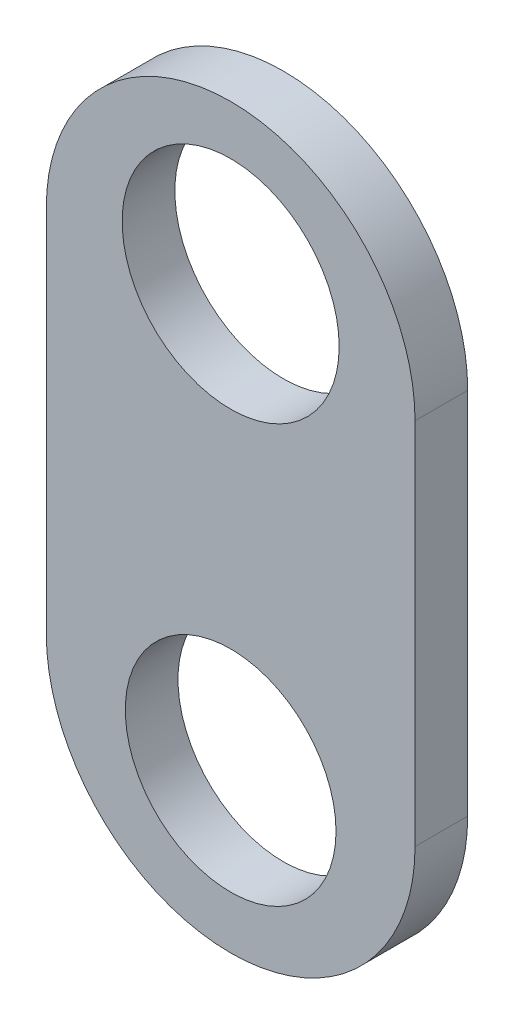
from build123d import *

# Parameters (mm, degrees)
SKETCH1_R           = 12.7
SKETCH1_R_2         = 13.081
BOSS_EXTRUDE1_DEPTH = 6.35


with BuildPart() as part:
    # Sketch1 → Boss-Extrude1 (new body)
    with BuildSketch(Plane.XY):
        with BuildLine():
            Line((22.225, -22.225), (22.225, 22.225))
            ThreePointArc((22.225, 22.225), (0, 44.45), (-22.225, 22.225))
            Line((-22.225, 22.225), (-22.225, -22.225))
            ThreePointArc((-22.225, -22.225), (0, -44.45), (22.225, -22.225))
        make_face()
        with Locations((0, -25.4)):
            Circle(SKETCH1_R, mode=Mode.SUBTRACT)
        with Locations((0, 25.4)):
            Circle(SKETCH1_R_2, mode=Mode.SUBTRACT)
    extrude(amount=BOSS_EXTRUDE1_DEPTH)


solid = part.part
